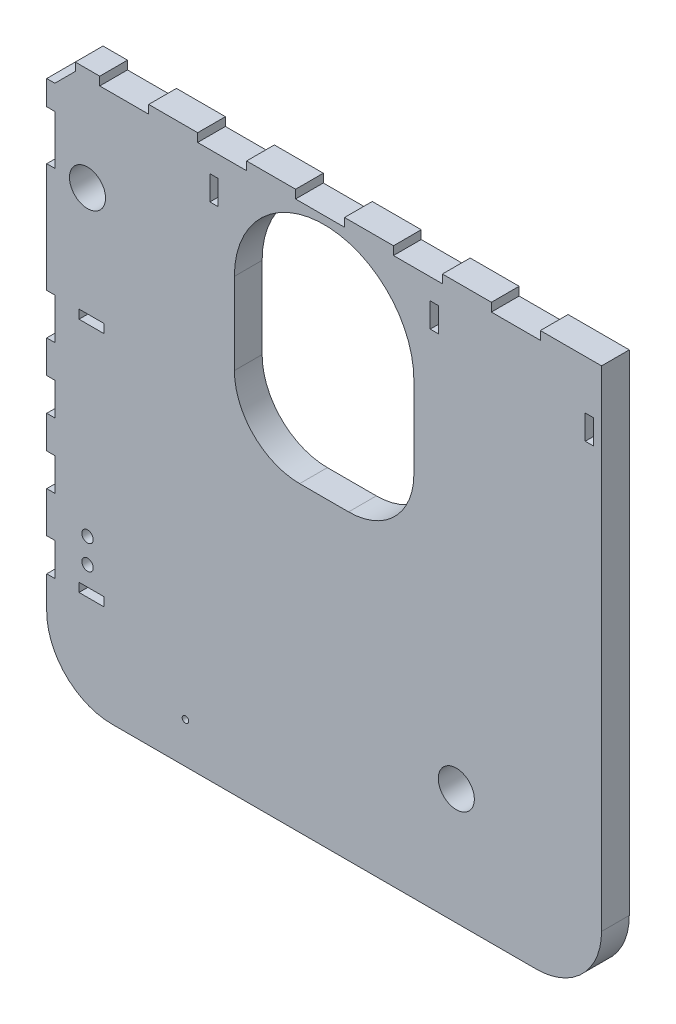
from build123d import *

# Parameters (mm, degrees)
MODEL_R             = 11.05
MODEL_R_2           = 2
MODEL_R_3           = 3.5
MODEL_W             = 15.4
MODEL_H             = 5.4
MODEL_W_2           = 5
MODEL_H_2           = 15
BOSS_EXTRUDE1_DEPTH = 17


with BuildPart() as part:
    # Model → Boss-Extrude1 (new body)
    with BuildSketch(Plane.XY):
        with BuildLine():
            Line((-158.978150708, -561.169218198), (-164.178150708, -561.169218198))
            Line((-164.178150708, -561.169218198), (-164.178150708, -628.419218198))
            Line((-164.178150708, -628.419218198), (-158.978150708, -628.419218198))
            Line((-158.978150708, -628.419218198), (-158.978150708, -653.619218198))
            Line((-158.978150708, -653.619218198), (-164.178150708, -653.619218198))
            Line((-164.178150708, -653.619218198), (-164.178150708, -673.619218198))
            Line((-164.178150708, -673.619218198), (-158.978150708, -673.619218198))
            Line((-158.978150708, -673.619218198), (-158.978150708, -693.619218198))
            Line((-158.978150708, -693.619218198), (-164.178150708, -693.619218198))
            Line((-164.178150708, -693.619218198), (-164.178150708, -713.619218198))
            Line((-164.178150708, -713.619218198), (-158.978150708, -713.619218198))
            Line((-158.978150708, -713.619218198), (-158.978150708, -733.619218198))
            Line((-158.978150708, -733.619218198), (-164.178150708, -733.619218198))
            Line((-164.178150708, -733.619218198), (-164.178150708, -758.619218198))
            Line((-164.178150708, -758.619218198), (-158.978150708, -758.619218198))
            Line((-158.978150708, -758.619218198), (-158.978150708, -778.819218198))
            Line((-158.978150708, -778.819218198), (-164.178150708, -778.819218198))
            Line((-164.178150708, -778.819218198), (-164.178150708, -798.619218198))
            ThreePointArc((-164.178150708, -798.619218198), (-152.462421956, -826.903489445), (-124.178150708, -838.619218198))
            Line((-124.178150708, -838.619218198), (135.821849292, -838.619218198))
            ThreePointArc((135.821849292, -838.619218198), (164.106120539, -826.903489445), (175.821849292, -798.619218198))
            Line((175.821849292, -798.619218198), (175.821849292, -498.469218198))
            Line((175.821849292, -498.469218198), (138.321849292, -498.469218198))
            Line((138.321849292, -498.469218198), (138.321849292, -503.669218198))
            Line((138.321849292, -503.669218198), (108.321849292, -503.669218198))
            Line((108.321849292, -503.669218198), (108.321849292, -498.469218198))
            Line((108.321849292, -498.469218198), (78.321849292, -498.469218198))
            Line((78.321849292, -498.469218198), (78.321849292, -503.669218198))
            Line((78.321849292, -503.669218198), (48.321849292, -503.669218198))
            Line((48.321849292, -503.669218198), (48.321849292, -498.469218198))
            Line((48.321849292, -498.469218198), (18.321849292, -498.469218198))
            Line((18.321849292, -498.469218198), (18.321849292, -503.669218198))
            Line((18.321849292, -503.669218198), (-11.678150708, -503.669218198))
            Line((-11.678150708, -503.669218198), (-11.678150708, -498.469218198))
            Line((-11.678150708, -498.469218198), (-41.678150708, -498.469218198))
            Line((-41.678150708, -498.469218198), (-41.678150708, -503.669218198))
            Line((-41.678150708, -503.669218198), (-71.678150708, -503.669218198))
            Line((-71.678150708, -503.669218198), (-71.678150708, -498.469218198))
            Line((-71.678150708, -498.469218198), (-101.678150708, -498.469218198))
            Line((-101.678150708, -498.469218198), (-101.678150708, -503.669218198))
            Line((-101.678150708, -503.669218198), (-131.678150708, -503.669218198))
            Line((-131.678150708, -503.669218198), (-131.678150708, -498.469218198))
            Line((-131.678150708, -498.469218198), (-146.678150708, -498.469218198))
            Line((-146.678150708, -498.469218198), (-146.678150708, -503.469218198))
            Line((-146.678150708, -503.469218198), (-159.178150708, -515.969218198))
            Line((-159.178150708, -515.969218198), (-164.178150708, -515.969218198))
            Line((-164.178150708, -515.969218198), (-164.178150708, -530.969218198))
            Line((-164.178150708, -530.969218198), (-158.978150708, -530.969218198))
            Line((-158.978150708, -530.969218198), (-158.978150708, -561.169218198))
        make_face()
        with Locations((86.821849292, -767.469218198)):
            Circle(MODEL_R, mode=Mode.SUBTRACT)
        with Locations((-139.178150708, -561.469218198)):
            Circle(MODEL_R, mode=Mode.SUBTRACT)
        with Locations((-79.178150708, -813.619218198)):
            Circle(MODEL_R_2, mode=Mode.SUBTRACT)
        with Locations((-139.178150708, -746.469218198)):
            Circle(MODEL_R_3, mode=Mode.SUBTRACT)
        with Locations((-139.178150708, -761.469218198)):
            Circle(MODEL_R_3, mode=Mode.SUBTRACT)
        with BuildLine():
            Line((60.821849292, -613.469218198), (60.821849292, -563.469218198))
            ThreePointArc((60.821849292, -563.469218198), (5.821849292, -508.469218198), (-49.178150708, -563.469218198))
            Line((-49.178150708, -563.469218198), (-49.178150708, -613.469218198))
            ThreePointArc((-49.178150708, -613.469218198), (-37.462421956, -641.753489445), (-9.178150708, -653.469218198))
            Line((-9.178150708, -653.469218198), (20.821849292, -653.469218198))
            ThreePointArc((20.821849292, -653.469218198), (49.106120539, -641.753489445), (60.821849292, -613.469218198))
        make_face(mode=Mode.SUBTRACT)
        with Locations((-136.678150708, -631.119218198)):
            Rectangle(MODEL_W, MODEL_H, mode=Mode.SUBTRACT)
        with Locations((-136.678150708, -776.119218198)):
            Rectangle(MODEL_W, MODEL_H, mode=Mode.SUBTRACT)
        with Locations((73.321849292, -523.969218198)):
            Rectangle(MODEL_W_2, MODEL_H_2, mode=Mode.SUBTRACT)
        with Locations((168.321849292, -535.969218198)):
            Rectangle(MODEL_W_2, MODEL_H_2, mode=Mode.SUBTRACT)
        with Locations((-61.678150708, -523.969218198)):
            Rectangle(MODEL_W_2, MODEL_H_2, mode=Mode.SUBTRACT)
    extrude(amount=BOSS_EXTRUDE1_DEPTH)


solid = part.part
